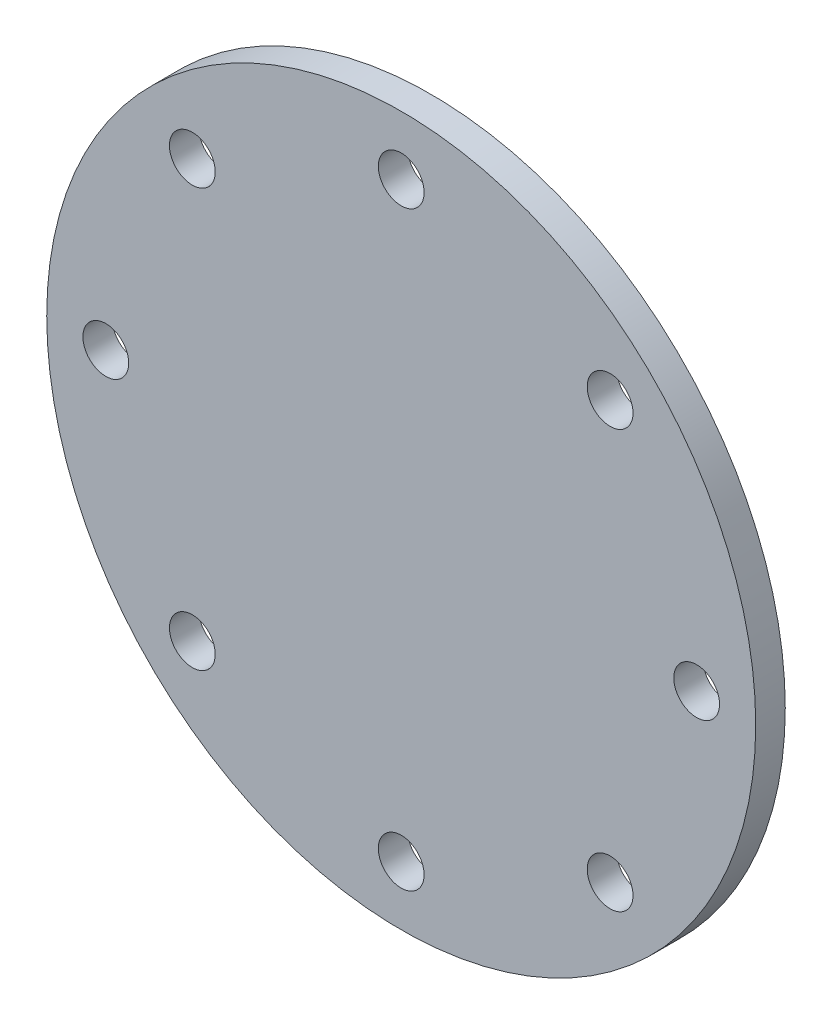
from build123d import *

# Parameters (mm, degrees)
SKETCH1_R           = 24
SKETCH1_R_2         = 1.55
BOSS_EXTRUDE1_DEPTH = 2


with BuildPart() as part:
    # Sketch1 → Boss-Extrude1 (new body)
    with BuildSketch(Plane.XY):
        Circle(SKETCH1_R)
        with Locations((0, 20)):
            Circle(SKETCH1_R_2, mode=Mode.SUBTRACT)
        with Locations((14.142135624, 14.142135624)):
            Circle(SKETCH1_R_2, mode=Mode.SUBTRACT)
        with Locations((20, 0)):
            Circle(SKETCH1_R_2, mode=Mode.SUBTRACT)
        with Locations((14.142135624, -14.142135624)):
            Circle(SKETCH1_R_2, mode=Mode.SUBTRACT)
        with Locations((0, -20)):
            Circle(SKETCH1_R_2, mode=Mode.SUBTRACT)
        with Locations((-14.142135624, -14.142135624)):
            Circle(SKETCH1_R_2, mode=Mode.SUBTRACT)
        with Locations((-20, 0)):
            Circle(SKETCH1_R_2, mode=Mode.SUBTRACT)
        with Locations((-14.142135624, 14.142135624)):
            Circle(SKETCH1_R_2, mode=Mode.SUBTRACT)
    extrude(amount=BOSS_EXTRUDE1_DEPTH)


solid = part.part
